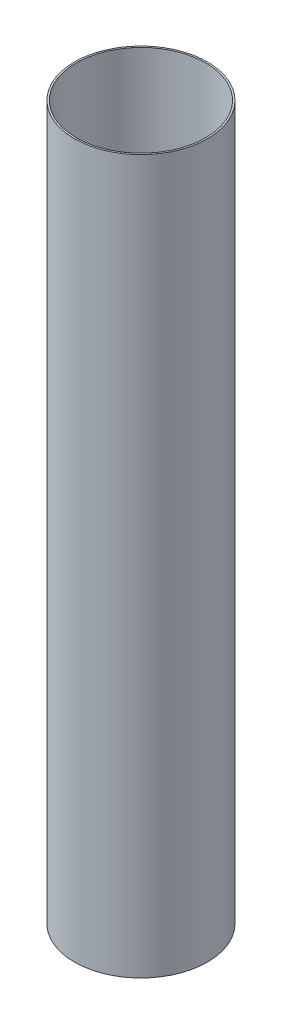
from build123d import *

# Parameters (mm, degrees)
SKETCH1_R           = 26.0604
SKETCH1_R_2         = 25.4
BOSS_EXTRUDE1_DEPTH = 279.4


with BuildPart() as part:
    # Sketch1 → Boss-Extrude1 (new body)
    with BuildSketch(Plane(origin=(0, 0, 0), x_dir=(1, 0, 0), z_dir=(0, 1, 0))):
        with Locations(Location((0, 0, 0), (0, 0, 270))):
            Circle(SKETCH1_R)
        with Locations(Location((0, 0, 0), (0, 0, 270))):
            Circle(SKETCH1_R_2, mode=Mode.SUBTRACT)
    extrude(amount=BOSS_EXTRUDE1_DEPTH)


solid = part.part
